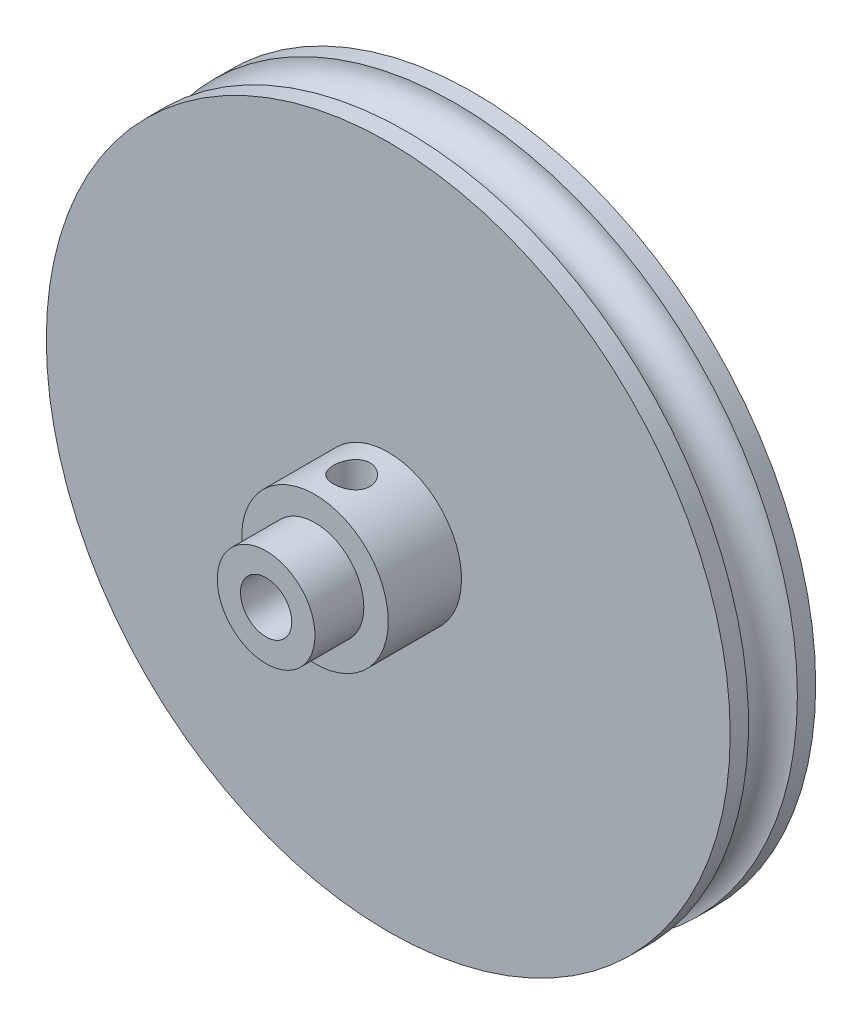
from build123d import *

# Parameters (mm, degrees)
ESQUISSE1_R                  = 28
BOSS_EXTRU_1_DEPTH           = 7
ESQUISSE2_R                  = 4
BOSS_EXTRU_2_DEPTH           = 10
ESQUISSE3_R                  = 2.1
ENL_V_MAT_EXTRU_1_DEPTH      = 44.092922853
ESQUISSE4_R                  = 2
ESQUISSE5_R                  = 6
ESQUISSE5_R_2                = 4
BOSS_EXTRU_3_DEPTH           = 6
ENL_V_MAT_EXTRU_2_REACH      = 45.093
ENL_V_MAT_EXTRU_2_END_RADIUS = 6
ESQUISSE6_R                  = 1.5


with BuildPart() as part:
    # Esquisse1 → Boss.-Extru.1 (new body)
    with BuildSketch(Plane.XY):
        Circle(ESQUISSE1_R)
    extrude(amount=BOSS_EXTRU_1_DEPTH)

    # Esquisse2 → Boss.-Extru.2 (add)
    with BuildSketch(Plane.XY.offset(7)):
        Circle(ESQUISSE2_R)
    extrude(amount=BOSS_EXTRU_2_DEPTH)

    # Esquisse3 → Enlèv. mat.-Extru.1 (cut, through all)
    with BuildSketch(Plane.XY.offset(17)):
        Circle(ESQUISSE3_R)
    extrude(amount=-ENL_V_MAT_EXTRU_1_DEPTH, mode=Mode.SUBTRACT)

    # Esquisse4 → Enlèvement de matière-Révolution1 (revolve, cut)
    with BuildSketch(Plane(origin=(0, 0, 0), x_dir=(0, 0, -1), z_dir=(1, 0, 0)), mode=Mode.PRIVATE) as enl_vement_de_mati_re_r_volution1_sk:
        with Locations((-3.5, 28)):
            Circle(ESQUISSE4_R)
    revolve(enl_vement_de_mati_re_r_volution1_sk.sketch.rotate(Axis((0, 0, 0), (0, 0, 1)), 90), axis=Axis((0, 0, 0), (0, 0, 1)), mode=Mode.SUBTRACT)

    # Esquisse5 → Boss.-Extru.3 (add)
    with BuildSketch(Plane.XY.offset(7)):
        Circle(ESQUISSE5_R)
        Circle(ESQUISSE5_R_2, mode=Mode.SUBTRACT)
    extrude(amount=BOSS_EXTRU_3_DEPTH)

    # Enlèv. mat.-Extru.2: up to this cylinder (the profile starts inside it)
    enl_v_mat_extru_2_end = Plane(origin=(0, 0, 10), z_dir=(0, 0, -1)) * Cylinder(ENL_V_MAT_EXTRU_2_END_RADIUS, 103.186, mode=Mode.PRIVATE)
    # Esquisse6 → Enlèv. mat.-Extru.2 (cut, up to the surface)
    with BuildSketch(Plane(origin=(0, 0, 0), x_dir=(1, 0, 0), z_dir=(0, 1, 0)), mode=Mode.PRIVATE) as enl_v_mat_extru_2_sk1:
        with Locations(Location((0, -10, 0), (0, 0, 90))):
            Circle(ESQUISSE6_R)
    enl_v_mat_extru_2_tool1 = extrude(enl_v_mat_extru_2_sk1.sketch, amount=ENL_V_MAT_EXTRU_2_REACH, mode=Mode.PRIVATE) & enl_v_mat_extru_2_end
    add(enl_v_mat_extru_2_tool1.solids().sort_by_distance((0, 0, 10))[0], mode=Mode.SUBTRACT)


solid = part.part
